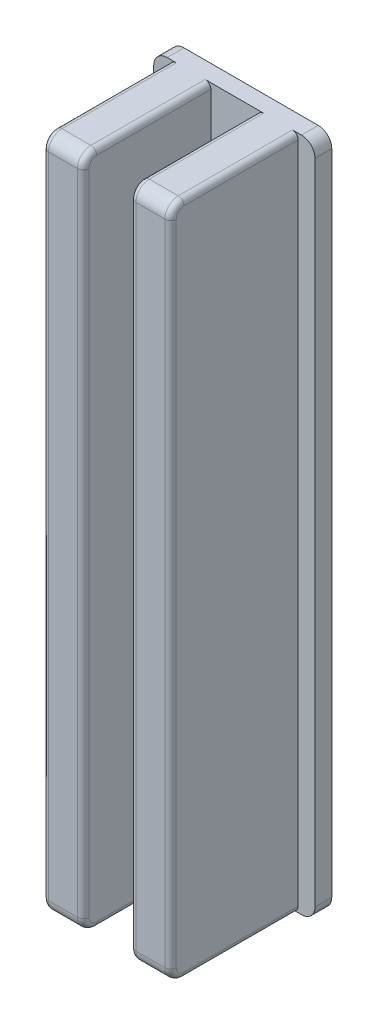
from build123d import *

# Parameters (mm, degrees)
SKETCH1_W           = 24
SKETCH1_H           = 100.5
BOSS_EXTRUDE1_DEPTH = 2.5
FILLET1_R           = 2
SKETCH2_W           = 6
SKETCH2_H           = 100.5
BOSS_EXTRUDE2_DEPTH = 19
SKETCH3_W           = 6
SKETCH3_H           = 12.5
BOSS_EXTRUDE3_DEPTH = 5
FILLET3_R           = 0.5
FILLET4_R           = 0.5
SKETCH4_R           = 1.4
CUT_EXTRUDE1_DEPTH  = 3
SKETCH5_R           = 1.5
CUT_EXTRUDE2_DEPTH  = 3
SKETCH6_W           = 3
SKETCH6_H           = 8
CUT_EXTRUDE3_DEPTH  = 0.8
CUT_EXTRUDE4_DEPTH  = 0.8
SKETCH8_W           = 101.427355931
SKETCH8_H           = 9.707106781
CUT_EXTRUDE5_DEPTH  = 105.515549199
FILLET2_R           = 2
FILLET5_R           = 0.85
CUT_EXTRUDE6_DEPTH  = 1


with BuildPart() as part:
    # Sketch1 → Boss-Extrude1 (new body)
    with BuildSketch(Plane(origin=(0, 0, 0), x_dir=(1, 0, 0), z_dir=(0, 0, -1))):
        with Locations((12, 50.25)):
            Rectangle(SKETCH1_W, SKETCH1_H)
    extrude(amount=BOSS_EXTRUDE1_DEPTH)

    # Fillet1
    fillet1_edges = [part.edges().sort_by_distance(p)[0] for p in [
        (0, -100.5, -1.25),
        (24, -100.5, -1.25),
        (24, 0, -1.25),
        (0, 0, -1.25),
    ]]
    fillet(fillet1_edges, radius=FILLET1_R)

    # Sketch2 → Boss-Extrude2 (add)
    with BuildSketch(Plane.XY):
        with Locations((5.5, -50.25)):
            Rectangle(SKETCH2_W, SKETCH2_H)
        with Locations((18.5, -50.25)):
            Rectangle(SKETCH2_W, SKETCH2_H)
    extrude(amount=BOSS_EXTRUDE2_DEPTH)

    # Sketch3 → Boss-Extrude3 (add)
    with BuildSketch(Plane(origin=(0, 0, 0), x_dir=(1, 0, 0), z_dir=(0, 1, 0))):
        with Locations((5.5, -12.75)):
            Rectangle(SKETCH3_W, SKETCH3_H)
        with Locations((18.5, -12.75)):
            Rectangle(SKETCH3_W, SKETCH3_H)
    extrude(amount=BOSS_EXTRUDE3_DEPTH)

    # Fillet3
    fillet3_edges = [part.edges().sort_by_distance(p)[0] for p in [
        (5.5, 5, 6.5),
        (18.5, 5, 6.5),
    ]]
    fillet(fillet3_edges, radius=FILLET3_R)

    # Fillet4
    fillet4_edges = [part.edges().sort_by_distance(p)[0] for p in [
        (5.5, 0, 6.5),
        (18.5, 0, 6.5),
    ]]
    fillet(fillet4_edges, radius=FILLET4_R)

    # Sketch4 → Cut-Extrude1 (cut)
    with BuildSketch(Plane(origin=(0, 0, -2.5), x_dir=(-1, 0, 0), z_dir=(0, 0, -1))):
        with Locations((-5.5, -86.5)):
            Circle(SKETCH4_R)
        with Locations((-18.5, -86.5)):
            Circle(SKETCH4_R)
        with Locations((-18.5, -16)):
            Circle(SKETCH4_R)
        with Locations((-5.5, -16)):
            Circle(SKETCH4_R)
    extrude(amount=-CUT_EXTRUDE1_DEPTH, mode=Mode.SUBTRACT)

    # Sketch5 → Cut-Extrude2 (cut)
    with BuildSketch(Plane.XY):
        with Locations((12, -43)):
            Circle(SKETCH5_R)
        with Locations((12, -51)):
            Circle(SKETCH5_R)
    extrude(amount=-CUT_EXTRUDE2_DEPTH, mode=Mode.SUBTRACT)

    # Sketch6 → Cut-Extrude3 (cut)
    with BuildSketch(Plane.XY):
        with Locations((12, -47)):
            Rectangle(SKETCH6_W, SKETCH6_H)
    extrude(amount=-CUT_EXTRUDE3_DEPTH, mode=Mode.SUBTRACT)

    # Sketch7 → Cut-Extrude4 (cut)
    # profile 1 of 2: a face of its own
    with BuildSketch(Plane(origin=(0, 0, -2.5), x_dir=(-1, 0, 0), z_dir=(0, 0, -1))):
        Polygon((-14.84983304, -60.426013104), (-14.513294579, -60.426013104), (-13.346627912, -63.184226245), (-12.179961245, -60.426013104), (-11.843422784, -60.426013104), (-13.324192015, -63.926013104), (-13.369063809, -63.926013104), align=None)
    # profile 2 of 2: a face of its own
    with BuildSketch(Plane(origin=(0, 0, -2.5), x_dir=(-1, 0, 0), z_dir=(0, 0, -1))):
        with BuildLine():
            add(Edge.make_bspline(
                [(-11.52932022, -62.177415348), (-11.528992201, -62.12131796), (-11.528355021, -62.012347976), (-11.521266601, -61.853563334), (-11.509491258, -61.704603045), (-11.493353885, -61.565459978), (-11.473715905, -61.436098214), (-11.447500419, -61.316863457), (-11.417687616, -61.20720385), (-11.38313517, -61.106761802), (-11.344147381, -61.014184099), (-11.30171312, -60.927758897), (-11.254148326, -60.847616965), (-11.204171413, -60.772479175), (-11.149759341, -60.70357548), (-11.092460551, -60.639932817), (-11.030038675, -60.583022067), (-10.964615666, -60.531175765), (-10.895599202, -60.485726293), (-10.824956536, -60.445693554), (-10.75220143, -60.411493687), (-10.677135247, -60.384603251), (-10.600432689, -60.362392404), (-10.521825623, -60.347203457), (-10.441184259, -60.337646548), (-10.386752824, -60.33673288), (-10.359147944, -60.336269514)],
                knots=[0, 0, 0, 0, 1.646270934, 3.197905019, 4.663502075, 6.030701355, 7.308322542, 8.50163776, 9.611534131, 10.641858119, 11.616356847, 12.558055219, 13.465016945, 14.349605745, 15.204443733, 16.039544428, 16.859896111, 17.680448484, 18.487036065, 19.28249412, 20.06191084, 20.843045899, 21.620316918, 22.403196591, 23.190181807, 24, 24, 24, 24], degree=3))
            add(Edge.make_bspline(
                [(-10.359147944, -60.336269514), (-10.331312466, -60.336757329), (-10.275956457, -60.33772744), (-10.194116081, -60.347051383), (-10.1141664, -60.362522506), (-10.036448261, -60.384443481), (-9.960323274, -60.411639157), (-9.886386867, -60.445726274), (-9.814179785, -60.485405142), (-9.744849498, -60.532029019), (-9.677634882, -60.584011295), (-9.614186919, -60.642773964), (-9.554499833, -60.707723683), (-9.497824528, -60.778165547), (-9.445768931, -60.855450632), (-9.396195499, -60.938234742), (-9.351823463, -61.027965607), (-9.309088788, -61.123146074), (-9.272201801, -61.226409733), (-9.238935556, -61.337174494), (-9.212056587, -61.456748681), (-9.189667315, -61.584504926), (-9.172322419, -61.720912409), (-9.159689777, -61.865678725), (-9.153016692, -62.018899115), (-9.15175999, -62.123656964), (-9.151115091, -62.177415348)],
                knots=[0, 0, 0, 0, 0.810914788, 1.612654377, 2.396697861, 3.181598691, 3.963628158, 4.749916497, 5.551656086, 6.361998678, 7.18212741, 8.025565596, 8.878627764, 9.750805457, 10.657531673, 11.591944965, 12.560506719, 13.57287815, 14.630710178, 15.753379473, 16.941251878, 18.199788006, 19.531962791, 20.947069417, 22.433333509, 24, 24, 24, 24], degree=3))
            add(Edge.make_bspline(
                [(-9.151115091, -62.177415348), (-9.151766676, -62.230939256), (-9.153036262, -62.335228407), (-9.159614969, -62.487759383), (-9.1725736, -62.631757426), (-9.188783588, -62.767567888), (-9.211234551, -62.894625507), (-9.238839717, -63.013369956), (-9.26949004, -63.124314027), (-9.307324834, -63.226548839), (-9.348735545, -63.321500562), (-9.393790741, -63.41016771), (-9.442060567, -63.493334003), (-9.494649312, -63.57033375), (-9.550702725, -63.641712407), (-9.611420514, -63.70621003), (-9.675091099, -63.765380702), (-9.742503515, -63.818032329), (-9.812915066, -63.864117134), (-9.884874143, -63.905330984), (-9.959657526, -63.938563679), (-10.035570479, -63.96709872), (-10.113698845, -63.988899172), (-10.193945236, -64.003973027), (-10.275901472, -64.014544876), (-10.331303037, -64.015351356), (-10.359147944, -64.015756694)],
                knots=[0, 0, 0, 0, 1.561518951, 3.042555995, 4.452378317, 5.7783523, 7.031515105, 8.214008947, 9.334062868, 10.386615937, 11.391082383, 12.354592575, 13.286541444, 14.194233754, 15.072674879, 15.931287219, 16.775624067, 17.606195743, 18.42308326, 19.229000347, 20.022332153, 20.807536673, 21.593273796, 22.3848459, 23.188221202, 24, 24, 24, 24], degree=3))
            add(Edge.make_bspline(
                [(-10.359147944, -64.015756694), (-10.386752058, -64.015290338), (-10.441181983, -64.014370776), (-10.521834408, -64.004857045), (-10.600116852, -63.989561542), (-10.676415606, -63.968144938), (-10.751122121, -63.941930101), (-10.823218407, -63.907776418), (-10.893506091, -63.868442349), (-10.961797647, -63.823646927), (-11.026809808, -63.772325244), (-11.088908413, -63.715560955), (-11.146533433, -63.651937544), (-11.200167528, -63.582459621), (-11.251141616, -63.507766379), (-11.29803099, -63.426838006), (-11.341401844, -63.339995395), (-11.381045334, -63.246677484), (-11.416193998, -63.145522557), (-11.447241706, -63.035373378), (-11.471755864, -62.915257742), (-11.492738819, -62.786140375), (-11.509663202, -62.647466444), (-11.521217527, -62.499160666), (-11.528358842, -62.341315457), (-11.528993913, -62.233045683), (-11.52932022, -62.177415348)],
                knots=[0, 0, 0, 0, 0.810891512, 1.598919785, 2.382837074, 3.152667961, 3.926044502, 4.706494248, 5.493654104, 6.291793342, 7.103789334, 7.925228297, 8.761435821, 9.622817696, 10.50288917, 11.416980706, 12.369136599, 13.353924996, 14.394355917, 15.514179734, 16.714354668, 17.994756427, 19.357759367, 20.818452758, 22.365282078, 24, 24, 24, 24], degree=3))
        make_face()
        with BuildLine():
            add(Edge.make_bspline(
                [(-11.215217656, -62.176013104), (-11.215098208, -62.222761803), (-11.214866385, -62.313491848), (-11.208810185, -62.445335109), (-11.200559953, -62.568305437), (-11.189918655, -62.682558974), (-11.174115707, -62.787708986), (-11.156408919, -62.884478669), (-11.134860829, -62.972355907), (-11.109365812, -63.051943717), (-11.080326715, -63.124592786), (-11.048620851, -63.192194001), (-11.014560128, -63.255545937), (-10.976440978, -63.314079546), (-10.934925914, -63.36798571), (-10.890952655, -63.418218542), (-10.842880071, -63.463015523), (-10.776376328, -63.516742378), (-10.688579854, -63.572261512), (-10.577959399, -63.620607602), (-10.464290948, -63.650990058), (-10.387139698, -63.654853814), (-10.348631117, -63.656782335)],
                knots=[0, 0, 0, 0, 1.459021318, 2.831673884, 4.118529203, 5.306027144, 6.411944654, 7.436330062, 8.375795394, 9.233974572, 10.042671642, 10.816086306, 11.563610507, 12.285937304, 12.993564865, 13.685989202, 14.367179055, 15.041617293, 16.353048772, 17.594441528, 18.799311195, 20, 20, 20, 20], degree=3))
            add(Edge.make_bspline(
                [(-10.348631117, -63.656782335), (-10.309873445, -63.655184554), (-10.232438122, -63.651992291), (-10.119304327, -63.621193554), (-10.009474057, -63.574724014), (-9.923402117, -63.519776509), (-9.857919573, -63.467448179), (-9.811002583, -63.422833531), (-9.767940535, -63.372877664), (-9.72709846, -63.318978368), (-9.689639384, -63.260105884), (-9.655576246, -63.196543308), (-9.624492899, -63.128114131), (-9.606783853, -63.080344391), (-9.597729675, -63.055920957)],
                knots=[0, 0, 0, 0, 1.353760809, 2.704726607, 4.075137775, 5.516104923, 6.260822281, 7.007110065, 7.778089737, 8.566572457, 9.372053459, 10.217411131, 11.088608312, 12, 12, 12, 12], degree=3))
            add(Edge.make_bspline(
                [(-9.597729675, -63.055920957), (-9.587177907, -63.024691217), (-9.565753293, -62.961281453), (-9.538141519, -62.862917801), (-9.51639612, -62.759715037), (-9.496832754, -62.65228992), (-9.483479698, -62.539850219), (-9.472731885, -62.422743835), (-9.466401198, -62.300882473), (-9.465616447, -62.218087482), (-9.465217656, -62.176013104)],
                knots=[0, 0, 0, 0, 0.884706709, 1.796334032, 2.740027952, 3.714592787, 4.726048262, 5.777819803, 6.87074269, 8, 8, 8, 8], degree=3))
            add(Edge.make_bspline(
                [(-9.465217656, -62.176013104), (-9.465767845, -62.133945531), (-9.466844133, -62.051652367), (-9.47095812, -61.931134186), (-9.481581695, -61.816666425), (-9.493380814, -61.707755952), (-9.510778035, -61.60500565), (-9.529535842, -61.507555344), (-9.554737054, -61.41661232), (-9.581656829, -61.330752738), (-9.612467224, -61.250952083), (-9.646382959, -61.176838297), (-9.682604717, -61.108053572), (-9.721946958, -61.044786631), (-9.763942641, -60.986754088), (-9.80970019, -60.935119493), (-9.857404563, -60.888282525), (-9.924221749, -60.834819956), (-10.011696039, -60.780308261), (-10.120541686, -60.730142501), (-10.23381233, -60.701334208), (-10.310385784, -60.697272521), (-10.348631117, -60.695243873)],
                knots=[0, 0, 0, 0, 1.31362396, 2.569729283, 3.763502607, 4.902122613, 5.988968491, 7.01645872, 7.998833611, 8.933434873, 9.825090667, 10.667526885, 11.477055099, 12.250526234, 12.991942729, 13.710640831, 14.402115721, 15.076753259, 16.378508321, 17.609869233, 18.806226677, 20, 20, 20, 20], degree=3))
            add(Edge.make_bspline(
                [(-10.348631117, -60.695243873), (-10.387341709, -60.69727532), (-10.464833415, -60.701341914), (-10.579281369, -60.730035168), (-10.688985721, -60.780048133), (-10.776228696, -60.835000506), (-10.843092482, -60.887338817), (-10.890175176, -60.932725271), (-10.934321348, -60.982371526), (-10.974989048, -61.036773441), (-11.013078331, -61.095238808), (-11.048059344, -61.158227573), (-11.079576673, -61.226058937), (-11.10866121, -61.298675372), (-11.134233998, -61.378256317), (-11.155327961, -61.46602531), (-11.174815014, -61.562487202), (-11.188610283, -61.66820671), (-11.200874039, -61.782488863), (-11.208755387, -61.905766182), (-11.214886644, -62.037830562), (-11.215105109, -62.129029721), (-11.215217656, -62.176013104)],
                knots=[0, 0, 0, 0, 1.207732386, 2.417664972, 3.655092373, 4.956220595, 5.625982001, 6.301752483, 6.994047911, 7.697131622, 8.419323945, 9.170223765, 9.943494443, 10.752040957, 11.610060368, 12.549350801, 13.567764191, 14.679664412, 15.874934091, 17.154273443, 18.533957287, 20, 20, 20, 20], degree=3))
        make_face(mode=Mode.SUBTRACT)
    extrude(amount=-CUT_EXTRUDE4_DEPTH, mode=Mode.SUBTRACT)

    # Sketch8 → Cut-Extrude5 (cut, through all)
    with BuildSketch(Plane.ZY.offset(-2.5)):
        with Locations((6.646446609, 4.853553391)):
            Rectangle(SKETCH8_W, SKETCH8_H)
    extrude(amount=-CUT_EXTRUDE5_DEPTH, mode=Mode.SUBTRACT)

    # Fillet2
    fillet2_edges = [part.edges().sort_by_distance(p)[0] for p in [
        (5.5, 0, 19),
        (18.5, 0, 19),
        (5.5, -100.5, 19),
        (18.5, -100.5, 19),
    ]]
    fillet(fillet2_edges, radius=FILLET2_R)

    # Fillet5
    fillet5_edges = [part.edges().sort_by_distance(p)[0] for p in [
        (2.5, 0, 8.5),
        (8.5, 0, 8.5),
        (15.5, 0, 8.5),
        (21.5, 0, 8.5),
        (21.5, -50.25, 19),
        (21.5, -100.5, 8.5),
        (21.5, -99.914213562, 18.414213562),
        (21.5, -0.585786438, 18.414213562),
        (15.5, -50.25, 19),
        (15.5, -100.5, 8.5),
        (15.5, -99.914213562, 18.414213562),
        (15.5, -0.585786438, 18.414213562),
        (8.5, -50.25, 19),
        (2.5, -50.25, 19),
        (2.5, -100.5, 8.5),
        (2.5, -99.914213562, 18.414213562),
        (2.5, -0.585786438, 18.414213562),
        (8.5, -100.5, 8.5),
        (8.5, -99.914213562, 18.414213562),
        (8.5, -0.585786438, 18.414213562),
    ]]
    fillet(fillet5_edges, radius=FILLET5_R)

    # Sketch9 → Cut-Extrude6 (cut)
    # profile 1 of 5: a face of its own
    with BuildSketch(Plane(origin=(0, 0, -2.5), x_dir=(-1, 0, 0), z_dir=(0, 0, -1))):
        Polygon((-15.858991277, -28.081981081), (-15.21185586, -28.081981081), (-15.21185586, -31.581981081), (-15.525958424, -31.581981081), (-15.525958424, -28.44095544), (-16.064419962, -28.44095544), align=None)
    # profile 2 of 5: a face of its own
    with BuildSketch(Plane(origin=(0, 0, -2.5), x_dir=(-1, 0, 0), z_dir=(0, 0, -1))):
        with BuildLine():
            add(Edge.make_bspline(
                [(-13.910573809, -29.833383324), (-13.91024579, -29.777285937), (-13.90960861, -29.668315952), (-13.90252019, -29.50953131), (-13.890744847, -29.360571021), (-13.874607474, -29.221427955), (-13.854969494, -29.092066191), (-13.828754008, -28.972831434), (-13.798941205, -28.863171827), (-13.764388759, -28.762729779), (-13.72540097, -28.670152075), (-13.682966709, -28.583726874), (-13.635401915, -28.503584942), (-13.585425002, -28.428447151), (-13.53101293, -28.359543457), (-13.47371414, -28.295900794), (-13.411292264, -28.238990044), (-13.345869255, -28.187143741), (-13.276852791, -28.14169427), (-13.206210125, -28.101661531), (-13.133455019, -28.067461664), (-13.058388836, -28.040571228), (-12.981686278, -28.018360381), (-12.903079212, -28.003171433), (-12.822437848, -27.993614525), (-12.768006413, -27.992700857), (-12.740401533, -27.992237491)],
                knots=[0, 0, 0, 0, 1.646270934, 3.197905019, 4.663502075, 6.030701355, 7.308322542, 8.50163776, 9.611534131, 10.641858119, 11.616356847, 12.558055219, 13.465016945, 14.349605745, 15.204443733, 16.039544428, 16.859896111, 17.680448484, 18.487036065, 19.28249412, 20.06191084, 20.843045899, 21.620316918, 22.403196591, 23.190181807, 24, 24, 24, 24], degree=3))
            add(Edge.make_bspline(
                [(-12.740401533, -27.992237491), (-12.712566055, -27.992725306), (-12.657210046, -27.993695417), (-12.57536967, -28.00301936), (-12.495419989, -28.018490483), (-12.41770185, -28.040411457), (-12.341576863, -28.067607134), (-12.267640456, -28.101694251), (-12.195433374, -28.141373118), (-12.126103087, -28.187996996), (-12.058888471, -28.239979272), (-11.995440508, -28.298741941), (-11.935753422, -28.36369166), (-11.879078117, -28.434133524), (-11.82702252, -28.511418609), (-11.777449088, -28.594202719), (-11.733077052, -28.683933583), (-11.690342377, -28.779114051), (-11.65345539, -28.88237771), (-11.620189145, -28.99314247), (-11.593310176, -29.112716657), (-11.570920904, -29.240472903), (-11.553576008, -29.376880386), (-11.540943366, -29.521646701), (-11.534270281, -29.674867092), (-11.533013579, -29.779624941), (-11.53236868, -29.833383324)],
                knots=[0, 0, 0, 0, 0.810914788, 1.612654377, 2.396697861, 3.181598691, 3.963628158, 4.749916497, 5.551656086, 6.361998678, 7.18212741, 8.025565596, 8.878627764, 9.750805457, 10.657531673, 11.591944965, 12.560506719, 13.57287815, 14.630710178, 15.753379473, 16.941251878, 18.199788006, 19.531962791, 20.947069417, 22.433333509, 24, 24, 24, 24], degree=3))
            add(Edge.make_bspline(
                [(-11.53236868, -29.833383324), (-11.533020265, -29.886907232), (-11.534289851, -29.991196384), (-11.540868558, -30.143727359), (-11.553827189, -30.287725403), (-11.570037177, -30.423535865), (-11.59248814, -30.550593484), (-11.620093306, -30.669337933), (-11.650743629, -30.780282004), (-11.688578423, -30.882516816), (-11.729989134, -30.977468539), (-11.77504433, -31.066135687), (-11.823314156, -31.14930198), (-11.875902901, -31.226301727), (-11.931956314, -31.297680384), (-11.992674103, -31.362178006), (-12.056344688, -31.421348678), (-12.123757104, -31.474000306), (-12.194168655, -31.52008511), (-12.266127732, -31.561298961), (-12.340911115, -31.594531656), (-12.416824068, -31.623066697), (-12.494952434, -31.644867149), (-12.575198825, -31.659941004), (-12.657155061, -31.670512853), (-12.712556626, -31.671319333), (-12.740401533, -31.67172467)],
                knots=[0, 0, 0, 0, 1.561518951, 3.042555995, 4.452378317, 5.7783523, 7.031515105, 8.214008947, 9.334062868, 10.386615937, 11.391082383, 12.354592575, 13.286541444, 14.194233754, 15.072674879, 15.931287219, 16.775624067, 17.606195743, 18.42308326, 19.229000347, 20.022332153, 20.807536673, 21.593273796, 22.3848459, 23.188221202, 24, 24, 24, 24], degree=3))
            add(Edge.make_bspline(
                [(-12.740401533, -31.67172467), (-12.768005647, -31.671258315), (-12.822435572, -31.670338753), (-12.903087997, -31.660825022), (-12.981370441, -31.645529518), (-13.057669195, -31.624112914), (-13.13237571, -31.597898078), (-13.204471996, -31.563744394), (-13.27475968, -31.524410325), (-13.343051236, -31.479614904), (-13.408063397, -31.428293221), (-13.470162002, -31.371528932), (-13.527787022, -31.307905521), (-13.581421117, -31.238427598), (-13.632395205, -31.163734355), (-13.679284579, -31.082805982), (-13.722655433, -30.995963372), (-13.762298923, -30.902645461), (-13.797447587, -30.801490533), (-13.828495295, -30.691341355), (-13.853009453, -30.571225719), (-13.873992408, -30.442108352), (-13.890916791, -30.303434421), (-13.902471116, -30.155128643), (-13.909612431, -29.997283434), (-13.910247502, -29.88901366), (-13.910573809, -29.833383324)],
                knots=[0, 0, 0, 0, 0.810891512, 1.598919785, 2.382837074, 3.152667961, 3.926044502, 4.706494248, 5.493654104, 6.291793342, 7.103789334, 7.925228297, 8.761435821, 9.622817696, 10.50288917, 11.416980706, 12.369136599, 13.353924996, 14.394355917, 15.514179734, 16.714354668, 17.994756427, 19.357759367, 20.818452758, 22.365282078, 24, 24, 24, 24], degree=3))
        make_face()
        with BuildLine():
            add(Edge.make_bspline(
                [(-13.596471245, -29.831981081), (-13.596351797, -29.87872978), (-13.596119974, -29.969459824), (-13.590063774, -30.101303085), (-13.581813542, -30.224273414), (-13.571172244, -30.338526951), (-13.555369296, -30.443676963), (-13.537662508, -30.540446646), (-13.516114418, -30.628323883), (-13.490619401, -30.707911694), (-13.461580304, -30.780560762), (-13.42987444, -30.848161978), (-13.395813717, -30.911513914), (-13.357694567, -30.970047522), (-13.316179503, -31.023953686), (-13.272206244, -31.074186519), (-13.22413366, -31.1189835), (-13.157629917, -31.172710355), (-13.069833443, -31.228229489), (-12.959212988, -31.276575579), (-12.845544537, -31.306958035), (-12.768393287, -31.310821791), (-12.729884706, -31.312750312)],
                knots=[0, 0, 0, 0, 1.459021318, 2.831673884, 4.118529203, 5.306027144, 6.411944654, 7.436330062, 8.375795394, 9.233974572, 10.042671642, 10.816086306, 11.563610507, 12.285937304, 12.993564865, 13.685989202, 14.367179055, 15.041617293, 16.353048772, 17.594441528, 18.799311195, 20, 20, 20, 20], degree=3))
            add(Edge.make_bspline(
                [(-12.729884706, -31.312750312), (-12.691127034, -31.311152531), (-12.613691711, -31.307960268), (-12.500557916, -31.277161531), (-12.390727646, -31.230691991), (-12.304655706, -31.175744486), (-12.239173162, -31.123416156), (-12.192256172, -31.078801508), (-12.149194124, -31.028845641), (-12.108352049, -30.974946345), (-12.070892973, -30.91607386), (-12.036829835, -30.852511285), (-12.005746488, -30.784082107), (-11.988037442, -30.736312368), (-11.978983264, -30.711888933)],
                knots=[0, 0, 0, 0, 1.353760809, 2.704726607, 4.075137775, 5.516104923, 6.260822281, 7.007110065, 7.778089737, 8.566572457, 9.372053459, 10.217411131, 11.088608312, 12, 12, 12, 12], degree=3))
            add(Edge.make_bspline(
                [(-11.978983264, -30.711888933), (-11.968431496, -30.680659194), (-11.947006882, -30.61724943), (-11.919395108, -30.518885778), (-11.897649709, -30.415683014), (-11.878086343, -30.308257897), (-11.864733287, -30.195818196), (-11.853985474, -30.078711812), (-11.847654787, -29.95685045), (-11.846870036, -29.874055458), (-11.846471245, -29.831981081)],
                knots=[0, 0, 0, 0, 0.884706709, 1.796334032, 2.740027952, 3.714592787, 4.726048262, 5.777819803, 6.87074269, 8, 8, 8, 8], degree=3))
            add(Edge.make_bspline(
                [(-11.846471245, -29.831981081), (-11.847021434, -29.789913508), (-11.848097722, -29.707620343), (-11.852211709, -29.587102163), (-11.862835284, -29.472634402), (-11.874634403, -29.363723929), (-11.892031624, -29.260973626), (-11.910789431, -29.163523321), (-11.935990643, -29.072580296), (-11.962910418, -28.986720715), (-11.993720813, -28.90692006), (-12.027636548, -28.832806274), (-12.063858306, -28.764021549), (-12.103200547, -28.700754608), (-12.14519623, -28.642722065), (-12.190953779, -28.59108747), (-12.238658152, -28.544250502), (-12.305475338, -28.490787933), (-12.392949628, -28.436276237), (-12.501795275, -28.386110477), (-12.615065919, -28.357302185), (-12.691639373, -28.353240498), (-12.729884706, -28.35121185)],
                knots=[0, 0, 0, 0, 1.31362396, 2.569729283, 3.763502607, 4.902122613, 5.988968491, 7.01645872, 7.998833611, 8.933434873, 9.825090667, 10.667526885, 11.477055099, 12.250526234, 12.991942729, 13.710640831, 14.402115721, 15.076753259, 16.378508321, 17.609869233, 18.806226677, 20, 20, 20, 20], degree=3))
            add(Edge.make_bspline(
                [(-12.729884706, -28.35121185), (-12.768595298, -28.353243297), (-12.846087004, -28.357309891), (-12.960534958, -28.386003144), (-13.07023931, -28.43601611), (-13.157482285, -28.490968483), (-13.224346071, -28.543306794), (-13.271428765, -28.588693248), (-13.315574937, -28.638339503), (-13.356242637, -28.692741417), (-13.39433192, -28.751206785), (-13.429312933, -28.814195549), (-13.460830263, -28.882026914), (-13.489914799, -28.954643349), (-13.515487587, -29.034224294), (-13.53658155, -29.121993287), (-13.556068603, -29.218455179), (-13.569863872, -29.324174687), (-13.582127628, -29.43845684), (-13.590008976, -29.561734158), (-13.596140233, -29.693798539), (-13.596358698, -29.784997697), (-13.596471245, -29.831981081)],
                knots=[0, 0, 0, 0, 1.207732386, 2.417664972, 3.655092373, 4.956220595, 5.625982001, 6.301752483, 6.994047911, 7.697131622, 8.419323945, 9.170223765, 9.943494443, 10.752040957, 11.610060368, 12.549350801, 13.567764191, 14.679664412, 15.874934091, 17.154273443, 18.533957287, 20, 20, 20, 20], degree=3))
        make_face(mode=Mode.SUBTRACT)
    # profile 3 of 5: a face of its own
    with BuildSketch(Plane(origin=(0, 0, -2.5), x_dir=(-1, 0, 0), z_dir=(0, 0, -1))):
        with BuildLine():
            add(Edge.make_bspline(
                [(-11.218266116, -29.833383324), (-11.217938098, -29.777285937), (-11.217300918, -29.668315952), (-11.210212497, -29.50953131), (-11.198437155, -29.360571021), (-11.182299782, -29.221427955), (-11.162661802, -29.092066191), (-11.136446315, -28.972831434), (-11.106633513, -28.863171827), (-11.072081067, -28.762729779), (-11.033093278, -28.670152075), (-10.990659017, -28.583726874), (-10.943094223, -28.503584942), (-10.89311731, -28.428447151), (-10.838705238, -28.359543457), (-10.781406448, -28.295900794), (-10.718984571, -28.238990044), (-10.653561563, -28.187143741), (-10.584545099, -28.14169427), (-10.513902433, -28.101661531), (-10.441147327, -28.067461664), (-10.366081144, -28.040571228), (-10.289378586, -28.018360381), (-10.210771519, -28.003171433), (-10.130130155, -27.993614525), (-10.07569872, -27.992700857), (-10.048093841, -27.992237491)],
                knots=[0, 0, 0, 0, 1.646270934, 3.197905019, 4.663502075, 6.030701355, 7.308322542, 8.50163776, 9.611534131, 10.641858119, 11.616356847, 12.558055219, 13.465016945, 14.349605745, 15.204443733, 16.039544428, 16.859896111, 17.680448484, 18.487036065, 19.28249412, 20.06191084, 20.843045899, 21.620316918, 22.403196591, 23.190181807, 24, 24, 24, 24], degree=3))
            add(Edge.make_bspline(
                [(-10.048093841, -27.992237491), (-10.020258362, -27.992725306), (-9.964902353, -27.993695417), (-9.883061978, -28.00301936), (-9.803112296, -28.018490483), (-9.725394158, -28.040411457), (-9.649269171, -28.067607134), (-9.575332764, -28.101694251), (-9.503125682, -28.141373118), (-9.433795394, -28.187996996), (-9.366580779, -28.239979272), (-9.303132816, -28.298741941), (-9.24344573, -28.36369166), (-9.186770425, -28.434133524), (-9.134714828, -28.511418609), (-9.085141395, -28.594202719), (-9.040769359, -28.683933583), (-8.998034684, -28.779114051), (-8.961147698, -28.88237771), (-8.927881452, -28.99314247), (-8.901002484, -29.112716657), (-8.878613211, -29.240472903), (-8.861268315, -29.376880386), (-8.848635673, -29.521646701), (-8.841962588, -29.674867092), (-8.840705887, -29.779624941), (-8.840060988, -29.833383324)],
                knots=[0, 0, 0, 0, 0.810914788, 1.612654377, 2.396697861, 3.181598691, 3.963628158, 4.749916497, 5.551656086, 6.361998678, 7.18212741, 8.025565596, 8.878627764, 9.750805457, 10.657531673, 11.591944965, 12.560506719, 13.57287815, 14.630710178, 15.753379473, 16.941251878, 18.199788006, 19.531962791, 20.947069417, 22.433333509, 24, 24, 24, 24], degree=3))
            add(Edge.make_bspline(
                [(-8.840060988, -29.833383324), (-8.840712573, -29.886907232), (-8.841982159, -29.991196384), (-8.848560865, -30.143727359), (-8.861519497, -30.287725403), (-8.877729485, -30.423535865), (-8.900180448, -30.550593484), (-8.927785614, -30.669337933), (-8.958435937, -30.780282004), (-8.996270731, -30.882516816), (-9.037681441, -30.977468539), (-9.082736638, -31.066135687), (-9.131006464, -31.14930198), (-9.183595209, -31.226301727), (-9.239648622, -31.297680384), (-9.300366411, -31.362178006), (-9.364036996, -31.421348678), (-9.431449412, -31.474000306), (-9.501860963, -31.52008511), (-9.57382004, -31.561298961), (-9.648603423, -31.594531656), (-9.724516376, -31.623066697), (-9.802644742, -31.644867149), (-9.882891133, -31.659941004), (-9.964847369, -31.670512853), (-10.020248934, -31.671319333), (-10.048093841, -31.67172467)],
                knots=[0, 0, 0, 0, 1.561518951, 3.042555995, 4.452378317, 5.7783523, 7.031515105, 8.214008947, 9.334062868, 10.386615937, 11.391082383, 12.354592575, 13.286541444, 14.194233754, 15.072674879, 15.931287219, 16.775624067, 17.606195743, 18.42308326, 19.229000347, 20.022332153, 20.807536673, 21.593273796, 22.3848459, 23.188221202, 24, 24, 24, 24], degree=3))
            add(Edge.make_bspline(
                [(-10.048093841, -31.67172467), (-10.075697955, -31.671258315), (-10.130127879, -31.670338753), (-10.210780305, -31.660825022), (-10.289062748, -31.645529518), (-10.365361502, -31.624112914), (-10.440068017, -31.597898078), (-10.512164304, -31.563744394), (-10.582451988, -31.524410325), (-10.650743544, -31.479614904), (-10.715755705, -31.428293221), (-10.77785431, -31.371528932), (-10.835479329, -31.307905521), (-10.889113425, -31.238427598), (-10.940087513, -31.163734355), (-10.986976886, -31.082805982), (-11.03034774, -30.995963372), (-11.069991231, -30.902645461), (-11.105139895, -30.801490533), (-11.136187603, -30.691341355), (-11.16070176, -30.571225719), (-11.181684716, -30.442108352), (-11.198609099, -30.303434421), (-11.210163424, -30.155128643), (-11.217304739, -29.997283434), (-11.217939809, -29.88901366), (-11.218266116, -29.833383324)],
                knots=[0, 0, 0, 0, 0.810891512, 1.598919785, 2.382837074, 3.152667961, 3.926044502, 4.706494248, 5.493654104, 6.291793342, 7.103789334, 7.925228297, 8.761435821, 9.622817696, 10.50288917, 11.416980706, 12.369136599, 13.353924996, 14.394355917, 15.514179734, 16.714354668, 17.994756427, 19.357759367, 20.818452758, 22.365282078, 24, 24, 24, 24], degree=3))
        make_face()
        with BuildLine():
            add(Edge.make_bspline(
                [(-10.904163552, -29.831981081), (-10.904044105, -29.87872978), (-10.903812282, -29.969459824), (-10.897756081, -30.101303085), (-10.889505849, -30.224273414), (-10.878864552, -30.338526951), (-10.863061604, -30.443676963), (-10.845354816, -30.540446646), (-10.823806726, -30.628323883), (-10.798311708, -30.707911694), (-10.769272611, -30.780560762), (-10.737566748, -30.848161978), (-10.703506025, -30.911513914), (-10.665386874, -30.970047522), (-10.623871811, -31.023953686), (-10.579898552, -31.074186519), (-10.531825968, -31.1189835), (-10.465322225, -31.172710355), (-10.377525751, -31.228229489), (-10.266905295, -31.276575579), (-10.153236844, -31.306958035), (-10.076085594, -31.310821791), (-10.037577014, -31.312750312)],
                knots=[0, 0, 0, 0, 1.459021318, 2.831673884, 4.118529203, 5.306027144, 6.411944654, 7.436330062, 8.375795394, 9.233974572, 10.042671642, 10.816086306, 11.563610507, 12.285937304, 12.993564865, 13.685989202, 14.367179055, 15.041617293, 16.353048772, 17.594441528, 18.799311195, 20, 20, 20, 20], degree=3))
            add(Edge.make_bspline(
                [(-10.037577014, -31.312750312), (-9.998819342, -31.311152531), (-9.921384019, -31.307960268), (-9.808250224, -31.277161531), (-9.698419954, -31.230691991), (-9.612348013, -31.175744486), (-9.54686547, -31.123416156), (-9.49994848, -31.078801508), (-9.456886431, -31.028845641), (-9.416044357, -30.974946345), (-9.378585281, -30.91607386), (-9.344522143, -30.852511285), (-9.313438796, -30.784082107), (-9.29572975, -30.736312368), (-9.286675571, -30.711888933)],
                knots=[0, 0, 0, 0, 1.353760809, 2.704726607, 4.075137775, 5.516104923, 6.260822281, 7.007110065, 7.778089737, 8.566572457, 9.372053459, 10.217411131, 11.088608312, 12, 12, 12, 12], degree=3))
            add(Edge.make_bspline(
                [(-9.286675571, -30.711888933), (-9.276123804, -30.680659194), (-9.25469919, -30.61724943), (-9.227087416, -30.518885778), (-9.205342016, -30.415683014), (-9.185778651, -30.308257897), (-9.172425595, -30.195818196), (-9.161677781, -30.078711812), (-9.155347094, -29.95685045), (-9.154562343, -29.874055458), (-9.154163552, -29.831981081)],
                knots=[0, 0, 0, 0, 0.884706709, 1.796334032, 2.740027952, 3.714592787, 4.726048262, 5.777819803, 6.87074269, 8, 8, 8, 8], degree=3))
            add(Edge.make_bspline(
                [(-9.154163552, -29.831981081), (-9.154713741, -29.789913508), (-9.155790029, -29.707620343), (-9.159904017, -29.587102163), (-9.170527591, -29.472634402), (-9.18232671, -29.363723929), (-9.199723931, -29.260973626), (-9.218481738, -29.163523321), (-9.243682951, -29.072580296), (-9.270602726, -28.986720715), (-9.301413121, -28.90692006), (-9.335328855, -28.832806274), (-9.371550614, -28.764021549), (-9.410892855, -28.700754608), (-9.452888538, -28.642722065), (-9.498646087, -28.59108747), (-9.54635046, -28.544250502), (-9.613167645, -28.490787933), (-9.700641935, -28.436276237), (-9.809487583, -28.386110477), (-9.922758227, -28.357302185), (-9.999331681, -28.353240498), (-10.037577014, -28.35121185)],
                knots=[0, 0, 0, 0, 1.31362396, 2.569729283, 3.763502607, 4.902122613, 5.988968491, 7.01645872, 7.998833611, 8.933434873, 9.825090667, 10.667526885, 11.477055099, 12.250526234, 12.991942729, 13.710640831, 14.402115721, 15.076753259, 16.378508321, 17.609869233, 18.806226677, 20, 20, 20, 20], degree=3))
            add(Edge.make_bspline(
                [(-10.037577014, -28.35121185), (-10.076287606, -28.353243297), (-10.153779311, -28.357309891), (-10.268227266, -28.386003144), (-10.377931618, -28.43601611), (-10.465174593, -28.490968483), (-10.532038379, -28.543306794), (-10.579121072, -28.588693248), (-10.623267245, -28.638339503), (-10.663934945, -28.692741417), (-10.702024228, -28.751206785), (-10.737005241, -28.814195549), (-10.76852257, -28.882026914), (-10.797607106, -28.954643349), (-10.823179894, -29.034224294), (-10.844273858, -29.121993287), (-10.863760911, -29.218455179), (-10.87755618, -29.324174687), (-10.889819935, -29.43845684), (-10.897701283, -29.561734158), (-10.903832541, -29.693798539), (-10.904051005, -29.784997697), (-10.904163552, -29.831981081)],
                knots=[0, 0, 0, 0, 1.207732386, 2.417664972, 3.655092373, 4.956220595, 5.625982001, 6.301752483, 6.994047911, 7.697131622, 8.419323945, 9.170223765, 9.943494443, 10.752040957, 11.610060368, 12.549350801, 13.567764191, 14.679664412, 15.874934091, 17.154273443, 18.533957287, 20, 20, 20, 20], degree=3))
        make_face(mode=Mode.SUBTRACT)
    # profile 4 of 5: a face of its own
    with BuildSketch(Plane(origin=(0, 0, -2.5), x_dir=(-1, 0, 0), z_dir=(0, 0, -1))):
        with BuildLine():
            add(Edge.make_bspline(
                [(-7.965060988, -31.043519542), (-7.945570776, -31.044677709), (-7.907362494, -31.046948159), (-7.852123365, -31.062524833), (-7.802128706, -31.090183494), (-7.757596461, -31.127046272), (-7.720889984, -31.171741935), (-7.692245632, -31.221337844), (-7.676804647, -31.277039436), (-7.674550735, -31.315469111), (-7.673394321, -31.335186209)],
                knots=[0, 0, 0, 0, 1.020151414, 1.999887582, 2.974338812, 3.990962822, 5.007586832, 5.987933904, 6.967670073, 8, 8, 8, 8], degree=3))
            add(Edge.make_bspline(
                [(-7.673394321, -31.335186209), (-7.674589922, -31.354429539), (-7.676947629, -31.392377102), (-7.692210237, -31.447658565), (-7.721108288, -31.497285469), (-7.757343281, -31.542587608), (-7.802139714, -31.579528478), (-7.852241561, -31.606951823), (-7.907232819, -31.623643803), (-7.945549142, -31.6257701), (-7.965060988, -31.626852876)],
                knots=[0, 0, 0, 0, 1.009421747, 1.99056486, 2.972319754, 3.999869655, 5.017953583, 5.993804169, 6.978383603, 8, 8, 8, 8], degree=3))
            add(Edge.make_bspline(
                [(-7.965060988, -31.626852876), (-7.984586894, -31.625809278), (-8.022706576, -31.623771903), (-8.077492571, -31.606609097), (-8.127899539, -31.579785637), (-8.172687251, -31.542518727), (-8.209225723, -31.497518584), (-8.236851105, -31.447316788), (-8.253441254, -31.39253535), (-8.255623127, -31.354460707), (-8.256727655, -31.335186209)],
                knots=[0, 0, 0, 0, 1.022052826, 1.995314843, 2.982371812, 4.00089066, 5.028879526, 6.005146991, 6.990147033, 8, 8, 8, 8], degree=3))
            add(Edge.make_bspline(
                [(-8.256727655, -31.335186209), (-8.255665556, -31.315436829), (-8.253591937, -31.276878589), (-8.236816277, -31.221679482), (-8.209440065, -31.171511043), (-8.17243467, -31.127114462), (-8.127910374, -31.08992716), (-8.077614169, -31.062862367), (-8.022574629, -31.046821954), (-7.98456469, -31.044639438), (-7.965060988, -31.043519542)],
                knots=[0, 0, 0, 0, 1.032775665, 2.016367738, 2.991239715, 4.008302682, 5.025365648, 6.011011707, 6.979408107, 8, 8, 8, 8], degree=3))
        make_face()
    # profile 5 of 5: a face of its own
    with BuildSketch(Plane(origin=(0, 0, -2.5), x_dir=(-1, 0, 0), z_dir=(0, 0, -1))):
        with BuildLine():
            Line((-5.025958424, -28.081981081), (-5.025958424, -28.44095544))
            Line((-5.025958424, -28.44095544), (-6.216463232, -28.44095544))
            Line((-6.216463232, -28.44095544), (-6.405064995, -29.361528356))
            add(Edge.make_bspline(
                [(-6.405064995, -29.361528356), (-6.36800912, -29.351298085), (-6.296219224, -29.331478551), (-6.190259363, -29.309472781), (-6.08966716, -29.296207336), (-6.024391789, -29.294396026), (-5.992805379, -29.293519542)],
                knots=[0, 0, 0, 0, 1.100273476, 2.13160584, 3.095893838, 4, 4, 4, 4], degree=3))
            add(Edge.make_bspline(
                [(-5.992805379, -29.293519542), (-5.953721639, -29.294365478), (-5.876873242, -29.296028799), (-5.764434295, -29.312000648), (-5.657101402, -29.337140563), (-5.555099032, -29.372261085), (-5.458238481, -29.417170818), (-5.36741092, -29.473270758), (-5.281253007, -29.538804089), (-5.201310413, -29.614149101), (-5.128786105, -29.697070718), (-5.065020115, -29.786228589), (-5.010857525, -29.880756251), (-4.96729677, -29.98155686), (-4.932512435, -30.087516013), (-4.909360441, -30.199748596), (-4.893943732, -30.317196716), (-4.892221345, -30.397501286), (-4.891343039, -30.438451433)],
                knots=[0, 0, 0, 0, 1.052922333, 2.070308379, 3.05430497, 4.020497103, 4.973039431, 5.925935799, 6.892292201, 7.88610001, 8.88166317, 9.857072816, 10.836096531, 11.812156883, 12.81219415, 13.836441305, 14.89672472, 16, 16, 16, 16], degree=3))
            add(Edge.make_bspline(
                [(-4.891343039, -30.438451433), (-4.892008115, -30.466973654), (-4.893329277, -30.523632641), (-4.900047865, -30.607776842), (-4.912983581, -30.690139675), (-4.930351305, -30.770732067), (-4.952893723, -30.849401439), (-4.980182777, -30.926372967), (-5.013578805, -31.001167574), (-5.05021018, -31.074492969), (-5.091456658, -31.144691476), (-5.137235165, -31.210340462), (-5.185600656, -31.272424744), (-5.237642042, -31.330278477), (-5.293843037, -31.383521495), (-5.353523004, -31.432469776), (-5.416205723, -31.477951107), (-5.482860965, -31.518119302), (-5.552003448, -31.555082258), (-5.624631665, -31.585405795), (-5.699092366, -31.612516323), (-5.776457241, -31.634125851), (-5.856551054, -31.651058406), (-5.939505829, -31.662559006), (-6.024886499, -31.670935444), (-6.082761512, -31.671459801), (-6.111996084, -31.67172467)],
                knots=[0, 0, 0, 0, 1.056347294, 2.098418968, 3.122841568, 4.141288669, 5.149314143, 6.15115421, 7.162517403, 8.180376062, 9.185164535, 10.17417709, 11.141909838, 12.097768115, 13.052685741, 14.0056014, 14.954263652, 15.917497458, 16.885230207, 17.854509472, 18.828990115, 19.81800267, 20.826176721, 21.857883937, 22.917946725, 24, 24, 24, 24], degree=3))
            add(Edge.make_bspline(
                [(-6.111996084, -31.67172467), (-6.146870265, -31.671033832), (-6.215481096, -31.66967469), (-6.316001663, -31.655456205), (-6.412716268, -31.635092289), (-6.50484637, -31.604456019), (-6.593217633, -31.566068724), (-6.676640351, -31.517552553), (-6.757246127, -31.462573449), (-6.831758164, -31.397693096), (-6.900914277, -31.326777414), (-6.962820786, -31.249819773), (-7.017954363, -31.168090331), (-7.06543211, -31.081192177), (-7.105930131, -30.989353646), (-7.13774512, -30.892230645), (-7.163423475, -30.790330641), (-7.174286895, -30.72017713), (-7.179804578, -30.684545183)],
                knots=[0, 0, 0, 0, 1.0467383, 2.05933395, 3.04377827, 4.011590433, 4.970194871, 5.932262533, 6.905835911, 7.896367577, 8.894135286, 9.877477877, 10.858688626, 11.851381753, 12.8477658, 13.868841284, 14.917554742, 16, 16, 16, 16], degree=3))
            Line((-7.179804578, -30.684545183), (-6.865702014, -30.684545183))
            add(Edge.make_bspline(
                [(-6.865702014, -30.684545183), (-6.857973456, -30.717921636), (-6.84311874, -30.782073031), (-6.810512991, -30.872204372), (-6.770647116, -30.952523596), (-6.723242767, -31.024093179), (-6.666692737, -31.086502176), (-6.602163308, -31.142119238), (-6.529815585, -31.192294367), (-6.449422355, -31.234117135), (-6.364609276, -31.269785888), (-6.275842066, -31.293537583), (-6.185537719, -31.310238476), (-6.124459349, -31.311910237), (-6.093766918, -31.312750312)],
                knots=[0, 0, 0, 0, 1.136247022, 2.183929868, 3.172523383, 4.106158343, 5.02341133, 5.958108904, 6.928429099, 7.938127109, 8.96079061, 9.975095812, 10.982467395, 12, 12, 12, 12], degree=3))
            add(Edge.make_bspline(
                [(-6.093766918, -31.312750312), (-6.063808473, -31.311929534), (-6.004820051, -31.310313415), (-5.918008664, -31.297874403), (-5.83419579, -31.278716832), (-5.754208433, -31.250046977), (-5.676646894, -31.215202258), (-5.603473123, -31.170487183), (-5.532570246, -31.119027164), (-5.466142113, -31.060070534), (-5.405302663, -30.995100839), (-5.351546542, -30.925623446), (-5.306769629, -30.851506599), (-5.26903552, -30.774033447), (-5.240382221, -30.692354889), (-5.21994124, -30.606853714), (-5.207938181, -30.517318734), (-5.206287001, -30.456249424), (-5.205445604, -30.425130119)],
                knots=[0, 0, 0, 0, 1.027316725, 2.022795036, 3.002884548, 3.971462791, 4.93288096, 5.914575861, 6.907176829, 7.935150275, 8.956128384, 9.956726525, 10.942570165, 11.921478529, 12.907843606, 13.90538589, 14.932640048, 16, 16, 16, 16], degree=3))
            add(Edge.make_bspline(
                [(-5.205445604, -30.425130119), (-5.206104083, -30.397054368), (-5.207392963, -30.342100079), (-5.217923533, -30.261700872), (-5.236240505, -30.18562783), (-5.261664385, -30.113513596), (-5.293943893, -30.045290153), (-5.333390205, -29.980887093), (-5.380743603, -29.92115326), (-5.434835492, -29.866060706), (-5.494093533, -29.815215832), (-5.559537276, -29.771871745), (-5.629797202, -29.735407827), (-5.704026802, -29.703939829), (-5.7839917, -29.681339084), (-5.868108333, -29.664371198), (-5.957285041, -29.654555836), (-6.018255729, -29.653193947), (-6.049596245, -29.652493901)],
                knots=[0, 0, 0, 0, 1.045622112, 2.046656509, 3.013763289, 3.955457236, 4.890082067, 5.820317437, 6.762574623, 7.722996705, 8.69280354, 9.665887285, 10.63943826, 11.638615906, 12.663482002, 13.728887084, 14.832589034, 16, 16, 16, 16], degree=3))
            add(Edge.make_bspline(
                [(-6.049596245, -29.652493901), (-6.076725173, -29.653074492), (-6.132739529, -29.654273266), (-6.218662355, -29.663099763), (-6.308954078, -29.677339057), (-6.403268574, -29.696925305), (-6.501889082, -29.722556381), (-6.604607483, -29.753270882), (-6.711639749, -29.789992881), (-6.783757474, -29.817725094), (-6.820830219, -29.831981081)],
                knots=[0, 0, 0, 0, 0.817624296, 1.688186739, 2.600797293, 3.572016777, 4.590301741, 5.671205678, 6.80286297, 8, 8, 8, 8], degree=3))
            Line((-6.820830219, -29.831981081), (-6.46185586, -28.081981081))
            Line((-6.46185586, -28.081981081), (-5.025958424, -28.081981081))
        make_face()
    extrude(amount=-CUT_EXTRUDE6_DEPTH, mode=Mode.SUBTRACT)


solid = part.part
